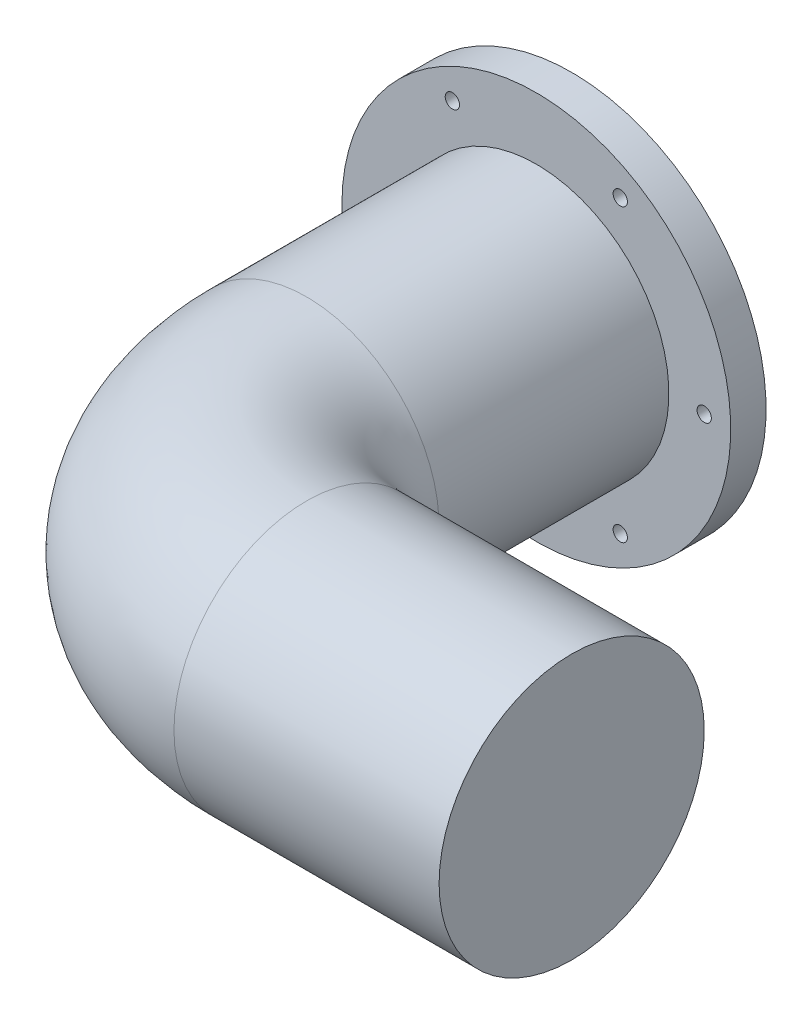
from build123d import *

# Parameters (mm, degrees)
SWEEP1_PROFILE_R               = 37.5
SKETCH3_R                      = 55
BOSS_EXTRUDE1_DEPTH            = 10
TAP_DRILL_FOR_10_32_TAP1_D     = 4.0386
TAP_DRILL_FOR_10_32_TAP1_DEPTH = 10
SKETCH11_R                     = 7
CUT_EXTRUDE1_DEPTH             = 5


with BuildPart() as part:
    # Sweep1: sweep along a path in Sketch1
    with BuildLine(Plane(origin=(0, 0, 0), x_dir=(1, 0, 0), z_dir=(0, 1, 0))) as sweep1_path:
        Line((0, 0), (-75, 0))
        ThreePointArc((-75, 0), (-110.355339059, 14.644660941), (-125, 50))
        Line((-125, 50), (-125, 125))
    # Sweep1 profile (on start of the path) → Sweep1 (sweep)
    with BuildSketch(Plane(origin=(0, 0, 0), x_dir=(0, 0, -1), z_dir=(-1, 0, 0))):
        Circle(SWEEP1_PROFILE_R)
    sweep(path=sweep1_path.line)

    # Sketch3 → Boss-Extrude1 (add)
    with BuildSketch(Plane(origin=(0, 0, -125), x_dir=(-1, 0, 0), z_dir=(0, 0, -1))):
        with Locations((125, 0)):
            Circle(SKETCH3_R)
    extrude(amount=-BOSS_EXTRUDE1_DEPTH)

    # Tap Drill for #10-32 Tap1
    with Locations(Plane.XY.offset(-115)):
        with Locations((-148.75, 41.13620668), (-172.5, 0), (-148.75, -41.13620668), (-101.25, -41.13620668), (-77.5, 0), (-101.25, 41.13620668)):
            Hole(TAP_DRILL_FOR_10_32_TAP1_D / 2, depth=TAP_DRILL_FOR_10_32_TAP1_DEPTH)

    # Sketch11 → Cut-Extrude1 (cut)
    with BuildSketch(Plane(origin=(0, 0, -125), x_dir=(-1, 0, 0), z_dir=(0, 0, -1))):
        with Locations((146.817216858, 16.740939298)):
            Circle(SKETCH11_R)
        with Locations((122.414911455, 27.378227065)):
            Circle(SKETCH11_R)
        with Locations((100.434896061, 12.361458995)):
            Circle(SKETCH11_R)
        with Locations((101.47297262, -14.238292828)):
            Circle(SKETCH11_R)
        with Locations((124.556438483, -27.496422552)):
            Circle(SKETCH11_R)
        with Locations((148.055532132, -14.989744431)):
            Circle(SKETCH11_R)
    extrude(amount=-CUT_EXTRUDE1_DEPTH, mode=Mode.SUBTRACT)


solid = part.part
